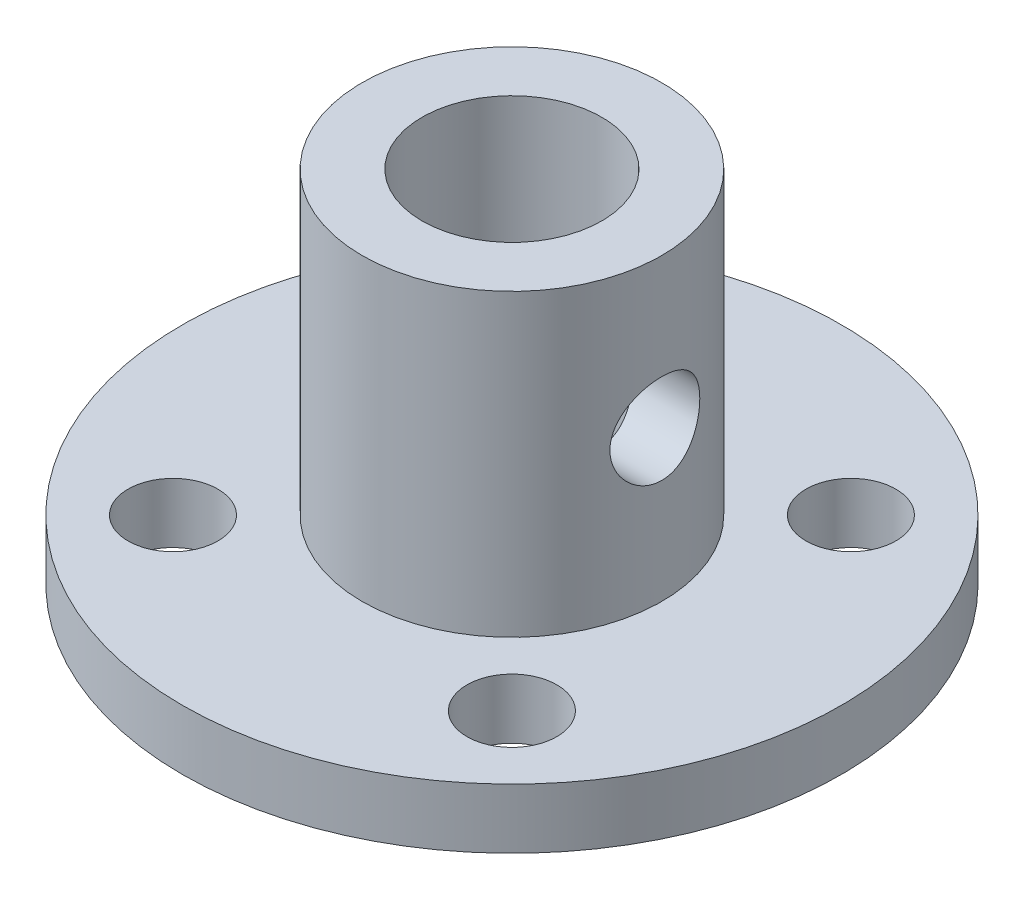
from build123d import *

# Parameters (mm, degrees)
SKETCH1_R           = 11
BOSS_EXTRUDE1_DEPTH = 2
SKETCH2_R           = 5
BOSS_EXTRUDE2_DEPTH = 10
SKETCH3_R           = 3
CUT_EXTRUDE1_DEPTH  = 20.646882704
SKETCH4_R           = 1.5
CUT_EXTRUDE2_DEPTH  = 19.493242009
CIRPATTERN1_COUNT   = 4
SKETCH5_R           = 1.5
CUT_EXTRUDE3_DEPTH  = 28.367864367


with BuildPart() as part:
    # Sketch1 → Boss-Extrude1 (new body)
    with BuildSketch(Plane(origin=(0, 0, 0), x_dir=(1, 0, 0), z_dir=(0, 1, 0))):
        with Locations(Location((0, 0, 0), (0, 0, 270))):
            Circle(SKETCH1_R)
    extrude(amount=BOSS_EXTRUDE1_DEPTH)

    # Sketch2 → Boss-Extrude2 (add)
    with BuildSketch(Plane(origin=(0, 2, 0), x_dir=(1, 0, 0), z_dir=(0, 1, 0))):
        with Locations(Location((0, 0, 0), (0, 0, 270))):
            Circle(SKETCH2_R)
    extrude(amount=BOSS_EXTRUDE2_DEPTH)

    # Sketch3 → Cut-Extrude1 (cut, through all)
    with BuildSketch(Plane(origin=(0, 12, 0), x_dir=(1, 0, 0), z_dir=(0, 1, 0))):
        with Locations(Location((0, 0, 0), (0, 0, 270))):
            Circle(SKETCH3_R)
    extrude(amount=-CUT_EXTRUDE1_DEPTH, mode=Mode.SUBTRACT)

    # Sketch4 → Cut-Extrude2 (cut, through all)
    with BuildSketch(Plane(origin=(0, 2, 0), x_dir=(1, 0, 0), z_dir=(0, 1, 0))):
        with Locations(Location((5.656854249, 5.656854249, 0), (0, 0, 270))):
            Circle(SKETCH4_R)
    cut_extrude2 = extrude(amount=-CUT_EXTRUDE2_DEPTH, mode=Mode.SUBTRACT)

    # CirPattern1: Cut-Extrude2 ×4 about axis
    cirpattern1_axis = Axis((0, 0, 0), (0, 1, 0))
    for i in range(1, CIRPATTERN1_COUNT):
        add(cut_extrude2.rotate(cirpattern1_axis, i * 360 / CIRPATTERN1_COUNT), mode=Mode.SUBTRACT)

    # Sketch5 → Cut-Extrude3 (cut, through all)
    with BuildSketch(Plane(origin=(11, 0, 0), x_dir=(0, 0, -1), z_dir=(1, 0, 0))):
        with Locations((0, 7)):
            Circle(SKETCH5_R)
    extrude(amount=-CUT_EXTRUDE3_DEPTH, mode=Mode.SUBTRACT)


solid = part.part
